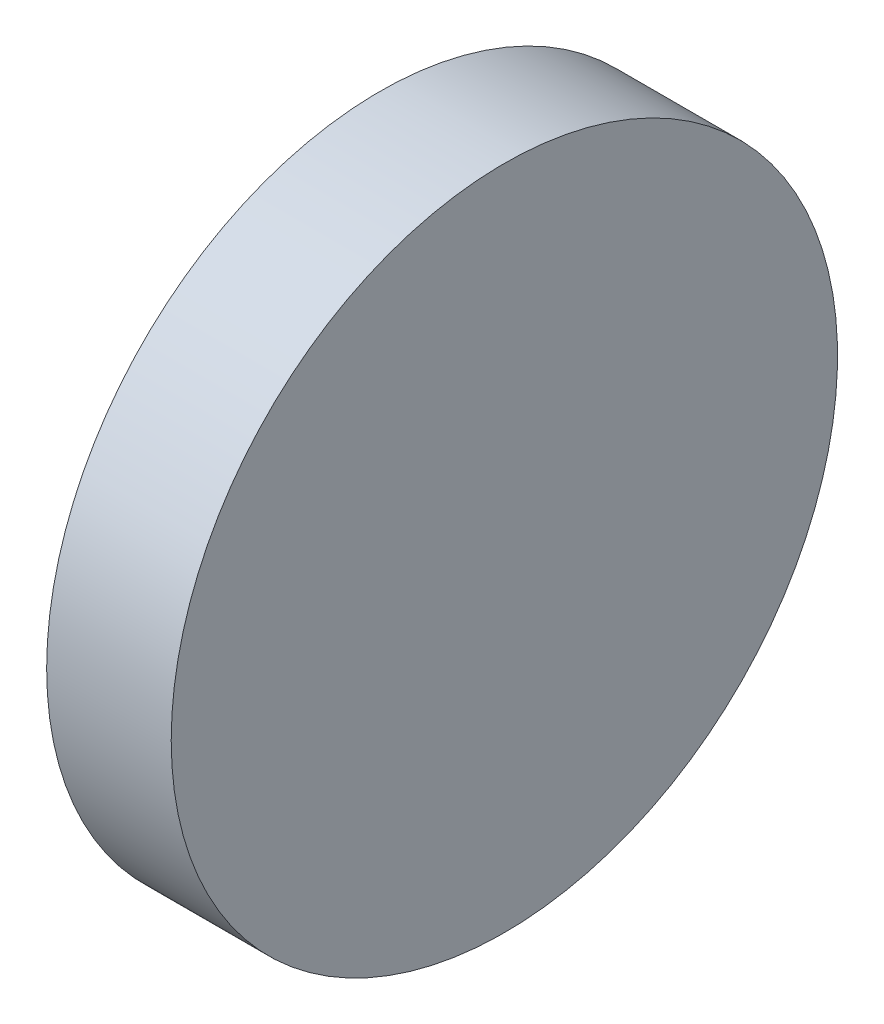
from build123d import *

# Parameters (mm, degrees)
SKETCH1_R           = 12.7381
BOSS_EXTRUDE1_DEPTH = 4.7625


with BuildPart() as part:
    # Sketch1 → Boss-Extrude1 (new body)
    with BuildSketch(Plane(origin=(0, 0, 0), x_dir=(0, 0, -1), z_dir=(1, 0, 0))):
        with Locations(Location((0, 0, 0), (0, 0, 180))):
            Circle(SKETCH1_R)
    extrude(amount=BOSS_EXTRUDE1_DEPTH)


solid = part.part
